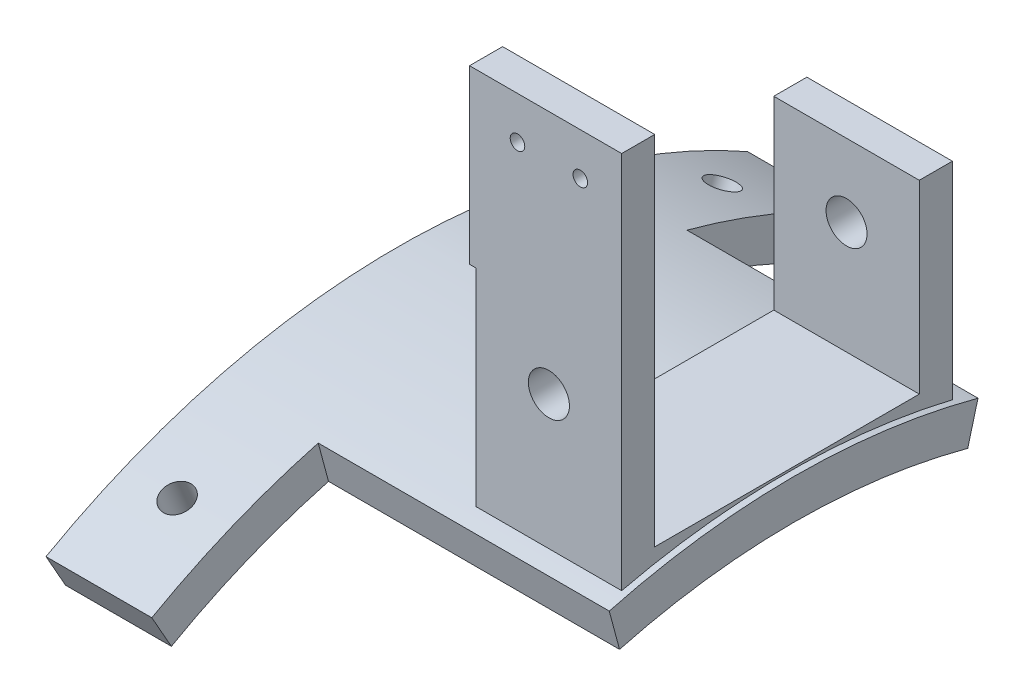
from build123d import *

# Parameters (mm, degrees)
ROW_SKETCH_W            = 16
ROW_SKETCH_H            = 6
ROW_ANGLE               = 59
HEEL_SKETCH_W           = 44
HEEL_SKETCH_H           = 6
HEEL_ANGLE              = 30
LUG_BLOCK_SKETCH_W      = 22
LUG_BLOCK_SKETCH_H      = 33
LUG_BLOCK_DEPTH         = 25
SLOT_SKETCH_W           = 32
SLOT_SKETCH_H           = 33
SLOT_DEPTH              = 20
PIN_HOLE_SKETCH_R       = 3.1
PIN_HOLE_DEPTH          = 30
TAB_SKETCH_W            = 23
TAB_SKETCH_H            = 26
TAB_DEPTH               = 5
SWITCH_HOLES_SKETCH_R   = 1.1
SWITCH_HOLES_DEPTH      = 30
SCREW_HOLE_1_SKETCH_R   = 2.25
SCREW_HOLE_1_DEPTH      = 200
SCREW_HOLE_1_SKETCH_2_R = 2.25
SCREW_HOLE_1_2_DEPTH    = 200


with BuildPart() as part:
    # Row Sketch → Row (revolve, symmetric)
    with BuildSketch(Plane.XY) as row_sk:
        with Locations((-896, 104.7)):
            Rectangle(ROW_SKETCH_W, ROW_SKETCH_H)
    revolve(axis=Axis((-3000, 0, 0), (1, 0, 0)), revolution_arc=ROW_ANGLE / 2)
    revolve(row_sk.sketch, axis=Axis((-3000, 0, 0), (-1, 0, 0)), revolution_arc=ROW_ANGLE / 2)

    # Heel Sketch → Heel (revolve, symmetric)
    with BuildSketch(Plane.XY) as heel_sk:
        with Locations((-866, 104.7)):
            Rectangle(HEEL_SKETCH_W, HEEL_SKETCH_H)
    revolve(axis=Axis((-3000, 0, 0), (1, 0, 0)), revolution_arc=HEEL_ANGLE / 2)
    revolve(heel_sk.sketch, axis=Axis((-3000, 0, 0), (-1, 0, 0)), revolution_arc=HEEL_ANGLE / 2)

    # Lug Block Sketch → Lug Block (add, symmetric)
    with BuildSketch(Plane.XY):
        with Locations((-856, 119.5)):
            Rectangle(LUG_BLOCK_SKETCH_W, LUG_BLOCK_SKETCH_H)
    extrude(amount=LUG_BLOCK_DEPTH, both=True)

    # Slot Sketch → Slot (cut, symmetric)
    with BuildSketch(Plane.XY):
        with Locations((-856, 124.5)):
            Rectangle(SLOT_SKETCH_W, SLOT_SKETCH_H)
    extrude(amount=SLOT_DEPTH, both=True, mode=Mode.SUBTRACT)

    # Pin Hole Sketch → Pin Hole (cut, symmetric)
    with BuildSketch(Plane.XY):
        with Locations((-856, 125)):
            Circle(PIN_HOLE_SKETCH_R)
    extrude(amount=PIN_HOLE_DEPTH, both=True, mode=Mode.SUBTRACT)

    # Tab Sketch → Tab (add)
    with BuildSketch(Plane.XY.offset(20)):
        with Locations((-856.5, 149)):
            Rectangle(TAB_SKETCH_W, TAB_SKETCH_H)
    extrude(amount=TAB_DEPTH)

    # Switch Holes Sketch → Switch Holes (cut, symmetric)
    with BuildSketch(Plane.XY):
        with Locations((-860.75, 155.6)):
            Circle(SWITCH_HOLES_SKETCH_R)
        with Locations((-851.25, 155.6)):
            Circle(SWITCH_HOLES_SKETCH_R)
    extrude(amount=SWITCH_HOLES_DEPTH, both=True, mode=Mode.SUBTRACT)

    # Screw Hole -1 Sketch → Screw Hole -1 (cut)
    with BuildSketch(Plane(origin=(0, 0, 0), x_dir=(-1, 0, 0), z_dir=(0, -0.9238795325112867, 0.38268343236508984))):
        with Locations((896, 0)):
            Circle(SCREW_HOLE_1_SKETCH_R)
    extrude(amount=-SCREW_HOLE_1_DEPTH, mode=Mode.SUBTRACT)

    # Screw Hole 1 Sketch 2 → Screw Hole 1 2 (cut)
    with BuildSketch(Plane(origin=(0, 0, 0), x_dir=(-1, 0, 0), z_dir=(0, -0.9238795325112867, -0.3826834323650897))):
        with Locations((896, 0)):
            Circle(SCREW_HOLE_1_SKETCH_2_R)
    extrude(amount=-SCREW_HOLE_1_2_DEPTH, mode=Mode.SUBTRACT)


solid = part.part
